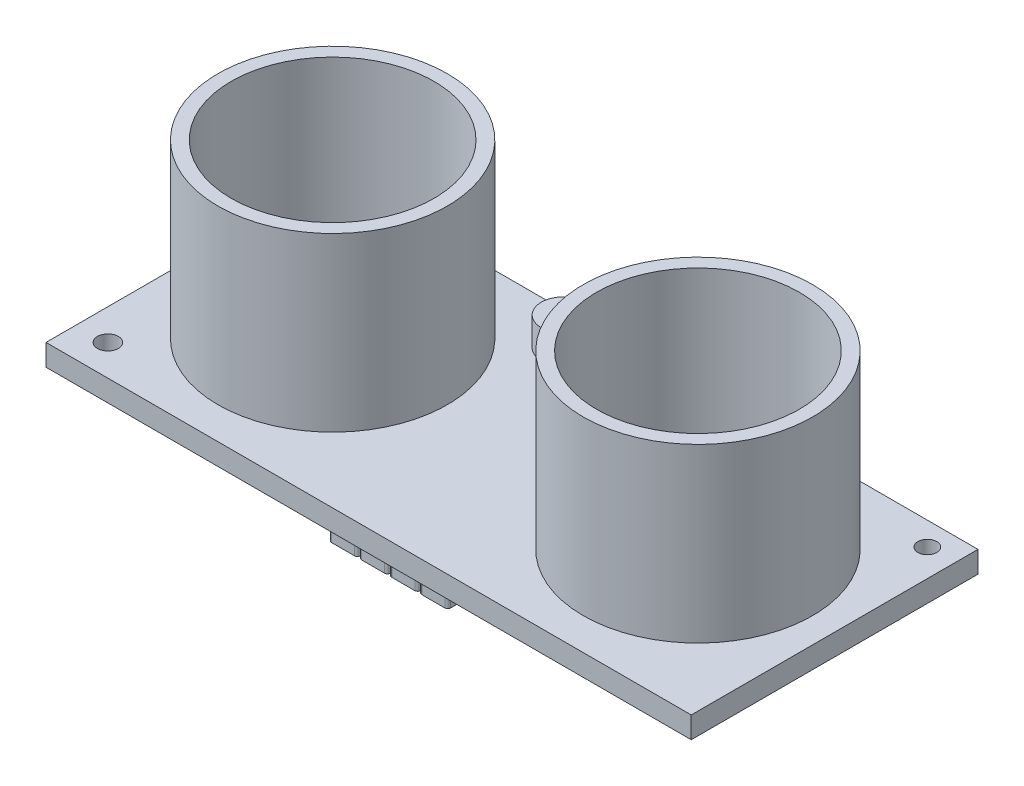
from build123d import *

# Parameters (mm, degrees)
SKETCH1_W              = 45
SKETCH1_H              = 20
BOSS_EXTRUDE2_DEPTH    = 1.5
SKETCH2_R              = 8
SKETCH2_R_2            = 7.072496476
BOSS_EXTRUDE3_DEPTH    = 12
BOSS_EXTRUDE4_DEPTH    = 2
SKETCH4_R              = 0.730672048
CUT_EXTRUDE6_DEPTH     = 22
SKETCH7_R              = 0.66039865
CUT_EXTRUDE9_DEPTH     = 11
SKETCH9_W              = 2
SKETCH9_H              = 2
BOSS_EXTRUDE5_DEPTH    = 2
FILLET2_R              = 0.2
LPATTERN1_COUNT        = 4
LPATTERN1_PITCH        = 2.1
FILLET2_OF_LPATTERN1_R = 0.2


with BuildPart() as part:
    # Sketch1 → Boss-Extrude2 (new body)
    with BuildSketch(Plane(origin=(0, 0, 0), x_dir=(1, 0, 0), z_dir=(0, 1, 0))):
        with Locations((-31.512400592, -30.621028873)):
            Rectangle(SKETCH1_W, SKETCH1_H)
    extrude(amount=BOSS_EXTRUDE2_DEPTH)

    # Sketch2 → Boss-Extrude3 (add)
    # profile 1 of 2: a face of its own
    with BuildSketch(Plane(origin=(0, 1.5, 0), x_dir=(1, 0, 0), z_dir=(0, 1, 0))):
        with Locations(Location((-44.251420367, -30.391308844, 0), (0, 0, 90))):
            Circle(SKETCH2_R)
        with Locations(Location((-44.251420367, -30.391308844, 0), (0, 0, 270))):
            Circle(SKETCH2_R_2, mode=Mode.SUBTRACT)
    # profile 2 of 2: a face of its own
    with BuildSketch(Plane(origin=(0, 1.5, 0), x_dir=(1, 0, 0), z_dir=(0, 1, 0))):
        with Locations(Location((-18.773380818, -30.391308844, 0), (0, 0, 90))):
            Circle(SKETCH2_R)
        with Locations(Location((-18.773380818, -30.391308844, 0), (0, 0, 90))):
            Circle(SKETCH2_R_2, mode=Mode.SUBTRACT)
    extrude(amount=BOSS_EXTRUDE3_DEPTH)

    # Sketch3 → Boss-Extrude4 (add)
    with BuildSketch(Plane(origin=(0, 1.5, 0), x_dir=(1, 0, 0), z_dir=(0, 1, 0))):
        with BuildLine():
            Line((-35.62647747, -21.369576807), (-27.62647747, -21.369576807))
            ThreePointArc((-27.62647747, -21.369576807), (-26.081088186, -22.914966091), (-27.62647747, -24.460355375))
            Line((-27.62647747, -24.460355375), (-35.62647747, -24.460355375))
            ThreePointArc((-35.62647747, -24.460355375), (-37.171866754, -22.914966091), (-35.62647747, -21.369576807))
        make_face()
    extrude(amount=BOSS_EXTRUDE4_DEPTH)

    # Sketch4 → Cut-Extrude6 (cut)
    with BuildSketch(Plane(origin=(0, 1.5, 0), x_dir=(1, 0, 0), z_dir=(0, 1, 0))):
        with Locations(Location((-51.851239407, -38.465008216, 0), (0, 0, 270))):
            Circle(SKETCH4_R)
    extrude(amount=-CUT_EXTRUDE6_DEPTH, mode=Mode.SUBTRACT)

    # Sketch7 → Cut-Extrude9 (cut)
    with BuildSketch(Plane(origin=(0, 1.5, 0), x_dir=(1, 0, 0), z_dir=(0, 1, 0))):
        with Locations(Location((-10.921132564, -22.246689644, 0), (0, 0, 270))):
            Circle(SKETCH7_R)
    extrude(amount=-CUT_EXTRUDE9_DEPTH, mode=Mode.SUBTRACT)

    # Sketch9 → Boss-Extrude5 (add)
    with BuildSketch(Plane.XZ):
        with Locations((-28.362400592, 38.253484629)):
            Rectangle(SKETCH9_W, SKETCH9_H)
    boss_extrude5 = extrude(amount=BOSS_EXTRUDE5_DEPTH)

    # Fillet2
    fillet2_edges = [part.edges().sort_by_distance(p)[0] for p in [
        (-27.362400592, -1, 37.253484629),
        (-27.362400592, -1, 39.253484629),
        (-29.362400592, -1, 39.253484629),
        (-29.362400592, -1, 37.253484629),
    ]]
    fillet(fillet2_edges, radius=FILLET2_R)

    # LPattern1: Boss-Extrude5 ×4
    with Locations(*[(-i * LPATTERN1_PITCH, 0, 0) for i in range(1, LPATTERN1_COUNT)]):
        add(boss_extrude5)

    # Fillet2 of LPattern1
    fillet2_of_lpattern1_edges = [part.edges().sort_by_distance(p)[0] for p in [
        (-29.462400592, -1, 37.253484629),
        (-29.462400592, -1, 39.253484629),
        (-31.462400592, -1, 39.253484629),
        (-31.462400592, -1, 37.253484629),
        (-31.562400592, -1, 37.253484629),
        (-31.562400592, -1, 39.253484629),
        (-33.562400592, -1, 39.253484629),
        (-33.562400592, -1, 37.253484629),
        (-33.662400592, -1, 37.253484629),
        (-33.662400592, -1, 39.253484629),
        (-35.662400592, -1, 39.253484629),
        (-35.662400592, -1, 37.253484629),
    ]]
    fillet(fillet2_of_lpattern1_edges, radius=FILLET2_OF_LPATTERN1_R)


solid = part.part
